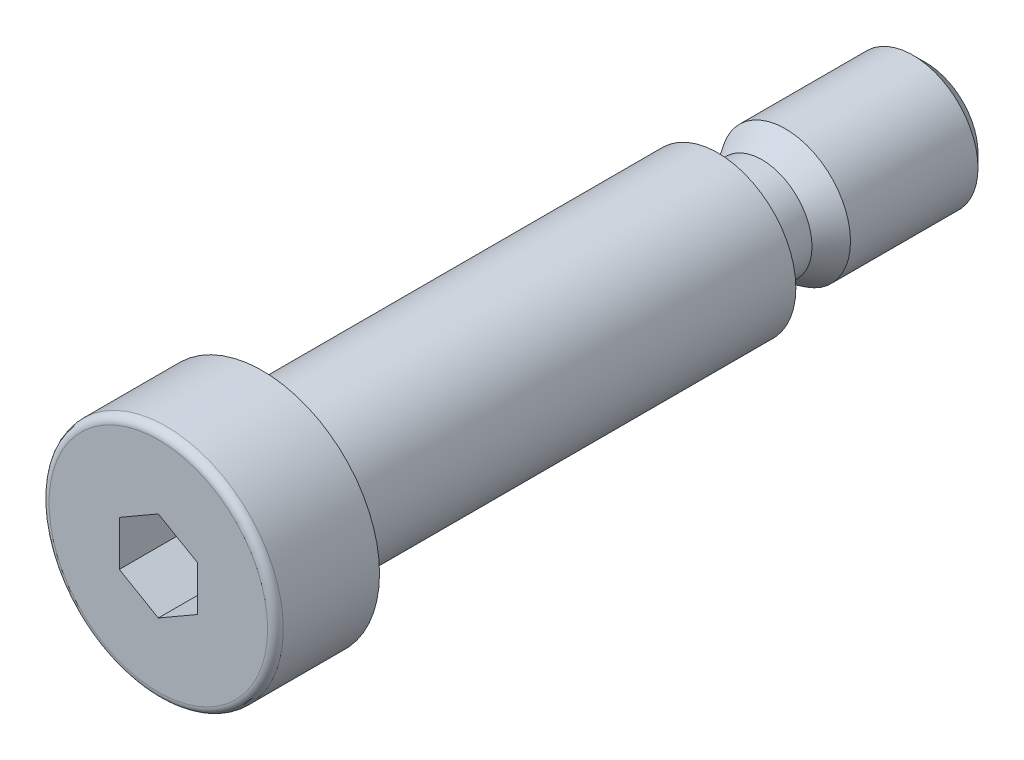
from build123d import *

# Parameters (mm, degrees)
SZKIC1_W                   = 3.85
SZKIC1_H                   = 3.39
WYTNIJ_WYCI_GNI_CIE1_DEPTH = 4.9
ZAOKR_GLENIE1_R            = 0.6


with BuildPart() as part:
    # Szkic1 → Obrót1 (revolve)
    with BuildSketch(Plane(origin=(0, 0, 0), x_dir=(1, 0, 0), z_dir=(0, 1, 0)), mode=Mode.PRIVATE) as obr_t1_sk:
        Polygon((0, -25.5), (0, -17.5), (-6, -17.5), (-9, -17.5), (-9, -25.5), align=None)
        Polygon((0, -17.5), (0, 17.5), (-3.85, 17.5), (-6, 17.5), (-6, -17.5), align=None)
        with Locations((-1.925, 19.195)):
            Rectangle(SZKIC1_W, SZKIC1_H)
        Polygon((-3.85, 20.89), (0, 20.89), (0, 33.5), (-4, 33.5), (-5, 32.5), (-5, 22.7), align=None)
    revolve(obr_t1_sk.sketch.rotate(Axis((0, 0, 25.5), (0, 0, -1)), 180), axis=Axis((0, 0, 25.5), (0, 0, -1)))

    # Szkic2 → Wytnij-wyciągnięcie1 (cut)
    with BuildSketch(Plane.XY.offset(25.5)):
        Polygon((3, 1.732050808), (0, 3.464101615), (-3, 1.732050808), (-3, -1.732050808), (0, -3.464101615), (3, -1.732050808), align=None)
    extrude(amount=-WYTNIJ_WYCI_GNI_CIE1_DEPTH, mode=Mode.SUBTRACT)

    # Zaokrąglenie1
    zaokr_glenie1_edges = [part.edges().sort_by_distance(p)[0] for p in [
        (-9, 0, 25.5),
    ]]
    fillet(zaokr_glenie1_edges, radius=ZAOKR_GLENIE1_R)


solid = part.part
